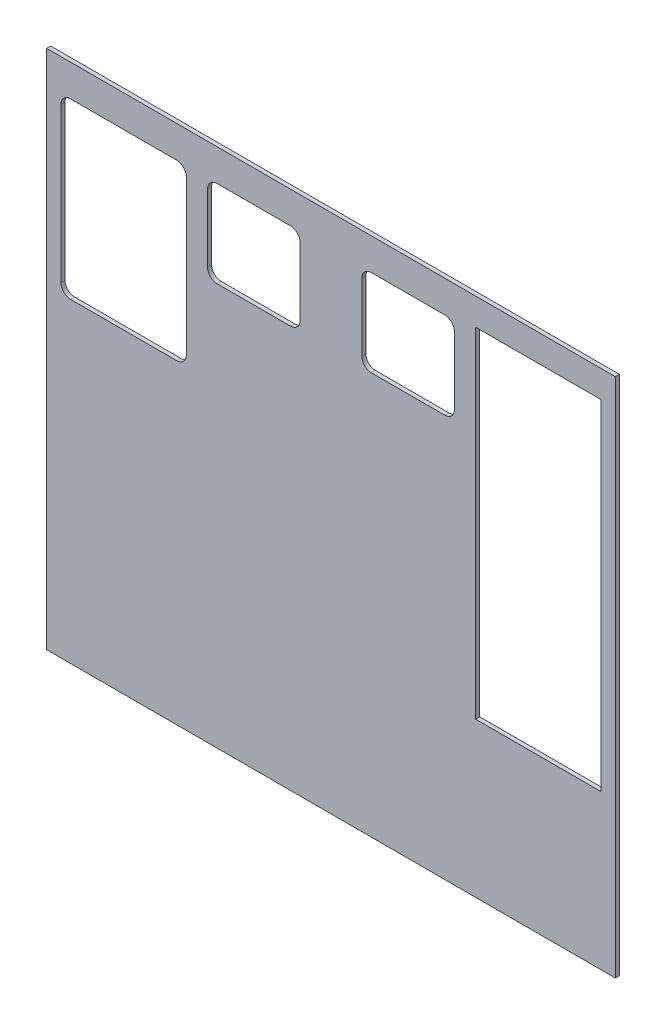
from build123d import *

# Parameters (mm, degrees)
SKETCH1_W                   = 82.55
SKETCH1_H                   = 223.52
BOSS_EXTRUDE1_DEPTH         = 2.667
CORNERRADIUSALLOWANCE_DEPTH = 408.419998422


with BuildPart() as part:
    # Sketch1 → Boss-Extrude1 (new body)
    with BuildSketch(Plane.XY):
        with BuildLine():
            Line((-193.04, 0), (-193.04, 349.25))
            ThreePointArc((-193.04, 349.25), (0, 358.775), (193.04, 349.25))
            Line((193.04, 349.25), (193.04, 0))
            Line((193.04, 0), (-193.04, 0))
        make_face()
        with BuildLine():
            Line((74.93, 264.795), (26.67, 264.795))
            ThreePointArc((26.67, 264.795), (22.179871939, 266.654871939), (20.32, 271.145))
            Line((20.32, 271.145), (20.32, 315.595))
            ThreePointArc((20.32, 315.595), (22.179871939, 320.085128061), (26.67, 321.945))
            Line((26.67, 321.945), (74.93, 321.945))
            ThreePointArc((74.93, 321.945), (79.420128061, 320.085128061), (81.28, 315.595))
            Line((81.28, 315.595), (81.28, 271.145))
            ThreePointArc((81.28, 271.145), (79.420128061, 266.654871939), (74.93, 264.795))
        make_face(mode=Mode.SUBTRACT)
        with BuildLine():
            Line((-171.45, 321.945), (-101.6, 321.945))
            ThreePointArc((-101.6, 321.945), (-97.109871939, 320.085128061), (-95.25, 315.595))
            Line((-95.25, 315.595), (-95.25, 213.995))
            ThreePointArc((-95.25, 213.995), (-97.109871939, 209.504871939), (-101.6, 207.645))
            Line((-101.6, 207.645), (-171.45, 207.645))
            ThreePointArc((-171.45, 207.645), (-175.940128061, 209.504871939), (-177.8, 213.995))
            Line((-177.8, 213.995), (-177.8, 315.595))
            ThreePointArc((-177.8, 315.595), (-175.940128061, 320.085128061), (-171.45, 321.945))
        make_face(mode=Mode.SUBTRACT)
        with BuildLine():
            Line((-74.93, 321.945), (-26.67, 321.945))
            ThreePointArc((-26.67, 321.945), (-22.179871939, 320.085128061), (-20.32, 315.595))
            Line((-20.32, 315.595), (-20.32, 271.145))
            ThreePointArc((-20.32, 271.145), (-22.179871939, 266.654871939), (-26.67, 264.795))
            Line((-26.67, 264.795), (-74.93, 264.795))
            ThreePointArc((-74.93, 264.795), (-79.420128061, 266.654871939), (-81.28, 271.145))
            Line((-81.28, 271.145), (-81.28, 315.595))
            ThreePointArc((-81.28, 315.595), (-79.420128061, 320.085128061), (-74.93, 321.945))
        make_face(mode=Mode.SUBTRACT)
        with Locations((136.525, 213.36)):
            Rectangle(SKETCH1_W, SKETCH1_H, mode=Mode.SUBTRACT)
    extrude(amount=BOSS_EXTRUDE1_DEPTH)

    # Sketch2 → CornerRadiusAllowance (cut, through all)
    with BuildSketch(Plane.XY.offset(2.667)):
        with BuildLine():
            Line((-187.198, 0), (-187.198, 342.9))
            Line((-187.198, 342.9), (0, 342.9))
            Line((0, 342.9), (0, 358.775))
            ThreePointArc((0, 358.775), (-96.63742446, 356.392302388), (-193.04, 349.25))
            Line((-193.04, 349.25), (-193.04, 0))
            Line((-193.04, 0), (-187.198, 0))
        make_face()
        with BuildLine():
            Line((0, 358.775), (0, 342.9))
            Line((0, 342.9), (187.198, 342.9))
            Line((187.198, 342.9), (187.198, 0))
            Line((187.198, 0), (193.04, 0))
            Line((193.04, 0), (193.04, 349.25))
            ThreePointArc((193.04, 349.25), (96.63742446, 356.392302388), (0, 358.775))
        make_face()
    extrude(amount=-CORNERRADIUSALLOWANCE_DEPTH, mode=Mode.SUBTRACT)


solid = part.part
